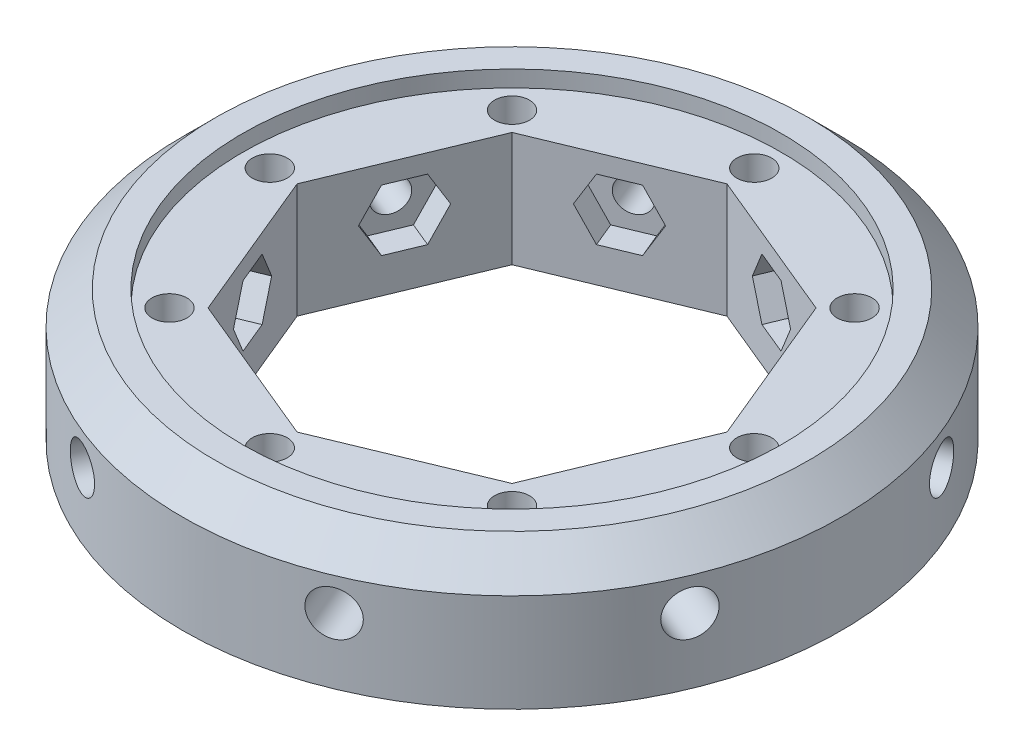
from build123d import *

# Parameters (mm, degrees)
SKETCH_1_R                = 30.196888946
EXTRUDE_1_DEPTH           = 12
CUT_EXTRUDE_1_DEPTH       = 2.4
SKETCH_3_R                = 1.5
CUT_EXTRUDE_2_DEPTH       = 3.6
SKETCH_6_R                = 2.05
CUT_EXTRUDE_3_DEPTH       = 67.802158421
PATTERN_CIRCULAR_25_COUNT = 8
CHAMFER_1_SIZE            = 3
SKETCH_7_R                = 24.696170665
CUT_EXTRUDE_4_DEPTH       = 1.5
SKETCH_8_R                = 1.6
CUT_EXTRUDE_5_DEPTH       = 44.976746335


with BuildPart() as part:
    # 草图1 → 凸台-拉伸1 (new body)
    with BuildSketch(Plane(origin=(0, 0, 0), x_dir=(1, 0, 0), z_dir=(0, 1, 0))):
        with Locations(Location((0, 0, 0), (0, 0, 270))):
            Circle(SKETCH_1_R)
        Polygon((13.927295841, 13.927295841), (0, 19.696170665), (-13.927295841, 13.927295841), (-19.696170665, 0), (-13.927295841, -13.927295841), (0, -19.696170665), (13.927295841, -13.927295841), (19.696170665, 0), align=None, mode=Mode.SUBTRACT)
    extrude(amount=EXTRUDE_1_DEPTH)

    # 草图2 → 切除-拉伸1 (cut)
    with BuildSketch(Plane(origin=(6.96364792, 0, -16.811733253), x_dir=(0.9238795325112867, 0, 0.38268343236508984), z_dir=(-0.38268343236508984, 0, 0.9238795325112867))):
        Polygon((3.233161507, 6), (1.616580754, 8.8), (-1.616580754, 8.8), (-3.233161507, 6), (-1.616580754, 3.2), (1.616580754, 3.2), align=None)
    cut_extrude_1 = extrude(amount=-CUT_EXTRUDE_1_DEPTH, mode=Mode.SUBTRACT)

    # 草图3 → 切除-拉伸2 (cut)
    with BuildSketch(Plane(origin=(7.882088158, 0, -19.029044131), x_dir=(0.9238795325112867, 0, 0.3826834323650899), z_dir=(-0.3826834323650899, 0, 0.9238795325112867))):
        with Locations((0, 6)):
            Circle(SKETCH_3_R)
    cut_extrude_2 = extrude(amount=-CUT_EXTRUDE_2_DEPTH, mode=Mode.SUBTRACT)

    # 草图6 → 切除-拉伸3 (cut, through all)
    with BuildSketch(Plane(origin=(9.259748515, 0, -22.355010448), x_dir=(0.923879532511287, 0, 0.38268343236508945), z_dir=(-0.38268343236508945, 0, 0.923879532511287))):
        with Locations((0, 6)):
            Circle(SKETCH_6_R)
    cut_extrude_3 = extrude(amount=-CUT_EXTRUDE_3_DEPTH, mode=Mode.SUBTRACT)

    # 阵列(圆周)25: 切除-拉伸1, 切除-拉伸2, 切除-拉伸3 ×8 about axis
    pattern_circular_25_axis = Axis((0, 0, 0), (0, 1, 0))
    add([cut_extrude_1.rotate(pattern_circular_25_axis, i * 360 / PATTERN_CIRCULAR_25_COUNT) for i in range(1, PATTERN_CIRCULAR_25_COUNT)], mode=Mode.SUBTRACT)
    add([cut_extrude_2.rotate(pattern_circular_25_axis, i * 360 / PATTERN_CIRCULAR_25_COUNT) for i in range(1, PATTERN_CIRCULAR_25_COUNT)], mode=Mode.SUBTRACT)
    add([cut_extrude_3.rotate(pattern_circular_25_axis, i * 360 / PATTERN_CIRCULAR_25_COUNT) for i in range(1, PATTERN_CIRCULAR_25_COUNT)], mode=Mode.SUBTRACT)

    # 倒角1
    chamfer_1_edges = [part.edges().sort_by_distance(p)[0] for p in [
        (0, 12, -30.196888946),
    ]]
    chamfer(chamfer_1_edges, length=CHAMFER_1_SIZE)

    # 草图7 → 切除-拉伸4 (cut)
    with BuildSketch(Plane(origin=(0, 12, 0), x_dir=(1, 0, 0), z_dir=(0, 1, 0))):
        with Locations(Location((0, 0, 0), (0, 0, 270))):
            Circle(SKETCH_7_R)
    extrude(amount=-CUT_EXTRUDE_4_DEPTH, mode=Mode.SUBTRACT)

    # 草图8 → 切除-拉伸5 (cut, through all)
    with BuildSketch(Plane(origin=(0, 10.5, 0), x_dir=(1, 0, 0), z_dir=(0, 1, 0))):
        with Locations(Location((0, 22.196170665, 0), (0, 0, 270))):
            Circle(SKETCH_8_R)
        with Locations(Location((15.695062794, 15.695062794, 0), (0, 0, 270))):
            Circle(SKETCH_8_R)
        with Locations(Location((22.196170665, 0, 0), (0, 0, 270))):
            Circle(SKETCH_8_R)
        with Locations(Location((15.695062794, -15.695062794, 0), (0, 0, 270))):
            Circle(SKETCH_8_R)
        with Locations(Location((0, -22.196170665, 0), (0, 0, 270))):
            Circle(SKETCH_8_R)
        with Locations(Location((-15.695062794, -15.695062794, 0), (0, 0, 270))):
            Circle(SKETCH_8_R)
        with Locations(Location((-22.196170665, 0, 0), (0, 0, 270))):
            Circle(SKETCH_8_R)
        with Locations(Location((-15.695062794, 15.695062794, 0), (0, 0, 270))):
            Circle(SKETCH_8_R)
    extrude(amount=-CUT_EXTRUDE_5_DEPTH, mode=Mode.SUBTRACT)


solid = part.part
